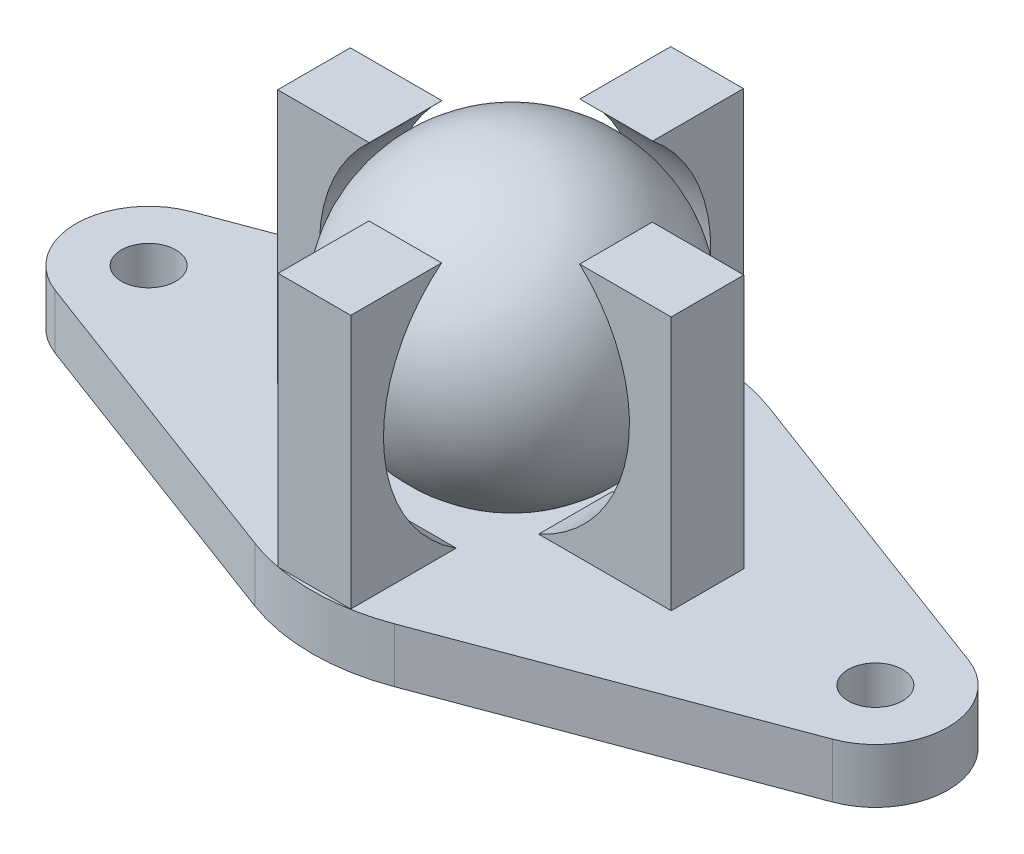
from build123d import *

# Parameters (mm, degrees)
CROQUIS1_R              = 1.5
SALIENTE_EXTRUIR1_DEPTH = 3
SALIENTE_EXTRUIR2_DEPTH = 4
SALIENTE_EXTRUIR3_DEPTH = 4


with BuildPart() as part:
    # Croquis1 → Saliente-Extruir1 (new body)
    with BuildSketch(Plane(origin=(0, 0, 0), x_dir=(1, 0, 0), z_dir=(0, 1, 0))):
        with BuildLine():
            Line((3.85, 10.304246697), (21.4, 3.746998799))
            ThreePointArc((21.4, 3.746998799), (24, 0), (21.4, -3.746998799))
            Line((21.4, -3.746998799), (3.85, -10.304246697))
            ThreePointArc((3.85, -10.304246697), (0, -11), (-3.85, -10.304246697))
            Line((-3.85, -10.304246697), (-21.4, -3.746998799))
            ThreePointArc((-21.4, -3.746998799), (-24, 0), (-21.4, 3.746998799))
            Line((-21.4, 3.746998799), (-3.85, 10.304246697))
            ThreePointArc((-3.85, 10.304246697), (0, 11), (3.85, 10.304246697))
        make_face()
        with Locations(Location((20, 0, 0), (0, 0, 270))):
            Circle(CROQUIS1_R, mode=Mode.SUBTRACT)
        with Locations(Location((-20, 0, 0), (0, 0, 90))):
            Circle(CROQUIS1_R, mode=Mode.SUBTRACT)
    extrude(amount=SALIENTE_EXTRUIR1_DEPTH)

    # Croquis3D1 → Saliente-Extruir2 (add)
    with BuildSketch(Plane(origin=(1.93230371, 3, -10.806862588), x_dir=(0, 0.5436521731456766, 0.8393106186829661), z_dir=(-1, 0, 0))):
        with BuildLine():
            Line((0, 0), (7.611130424, 11.750348662))
            Line((7.611130424, 11.750348662), (11.807683517, 9.032087796))
            ThreePointArc((11.807683517, 9.032087796), (5.215820101, 4.715586782), (4.872876352, -3.156340167))
            Line((4.872876352, -3.156340167), (0, 0))
        make_face()
        with BuildLine():
            Line((18.140629049, -11.750348662), (13.267752697, -8.594008495))
            ThreePointArc((13.267752697, -8.594008495), (20.311339254, -5.06233287), (21.55520638, 2.718260866))
            Line((21.55520638, 2.718260866), (25.751759473, 0))
            Line((25.751759473, 0), (18.140629049, -11.750348662))
        make_face()
    extrude(amount=SALIENTE_EXTRUIR2_DEPTH)

    # Croquis3D2 → Saliente-Extruir3 (add)
    with BuildSketch(Plane(origin=(10.828952044, 3, -1.93230371), x_dir=(-0.8398165749256806, 0.5428702611859474, 0), z_dir=(0, 0, -1))):
        with BuildLine():
            Line((0, 0), (7.600183657, 11.757432049))
            Line((7.600183657, 11.757432049), (11.832617517, 9.021522156))
            ThreePointArc((11.832617517, 9.021522156), (5.490362337, 4.063536139), (6.128199812, -3.961361959))
            Line((6.128199812, -3.961361959), (0, 0))
        make_face()
        with BuildLine():
            Line((18.188666831, -11.757432049), (12.060467019, -7.79607009))
            ThreePointArc((12.060467019, -7.79607009), (19.639638477, -5.082772071), (21.556416627, 2.735909893))
            Line((21.556416627, 2.735909893), (25.788850488, 0))
            Line((25.788850488, 0), (18.188666831, -11.757432049))
        make_face()
    extrude(amount=-SALIENTE_EXTRUIR3_DEPTH)


with BuildPart() as body_2:
    # Croquis3 → Revolución1 (revolve)
    with BuildSketch(Plane.XY):
        with BuildLine():
            Line((0, 3), (0, 19))
            ThreePointArc((0, 19), (-8, 11), (0, 3))
        make_face()
    revolve(axis=Axis((0, 3, 0), (0, 1, 0)))


solid = Compound([part.part, body_2.part])
